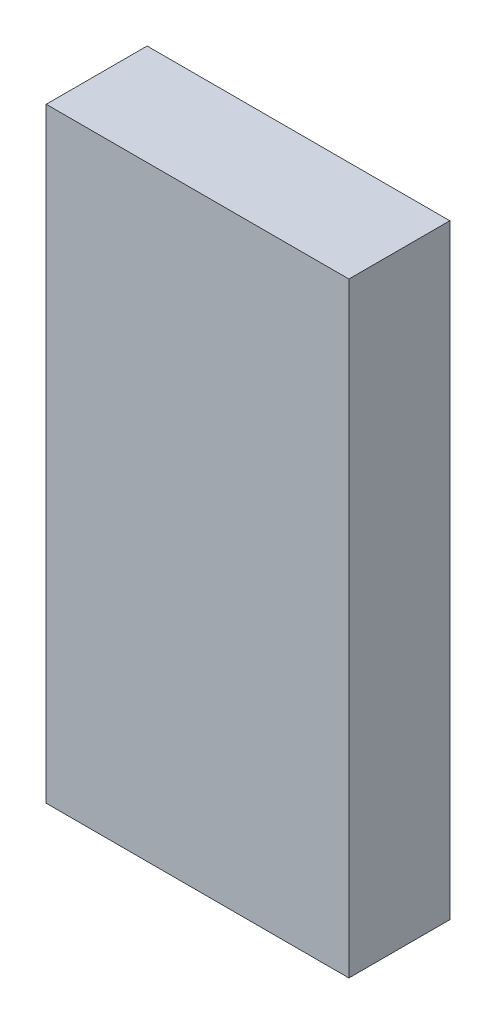
from build123d import *

# Parameters (mm, degrees)
SKETCH1_W           = 38.1
SKETCH1_H           = 76.2
BOSS_EXTRUDE1_DEPTH = 12.7


with BuildPart() as part:
    # Sketch1 → Boss-Extrude1 (new body)
    with BuildSketch(Plane.XY):
        with Locations((-19.05, -38.1)):
            Rectangle(SKETCH1_W, SKETCH1_H)
    extrude(amount=-BOSS_EXTRUDE1_DEPTH)


solid = part.part
